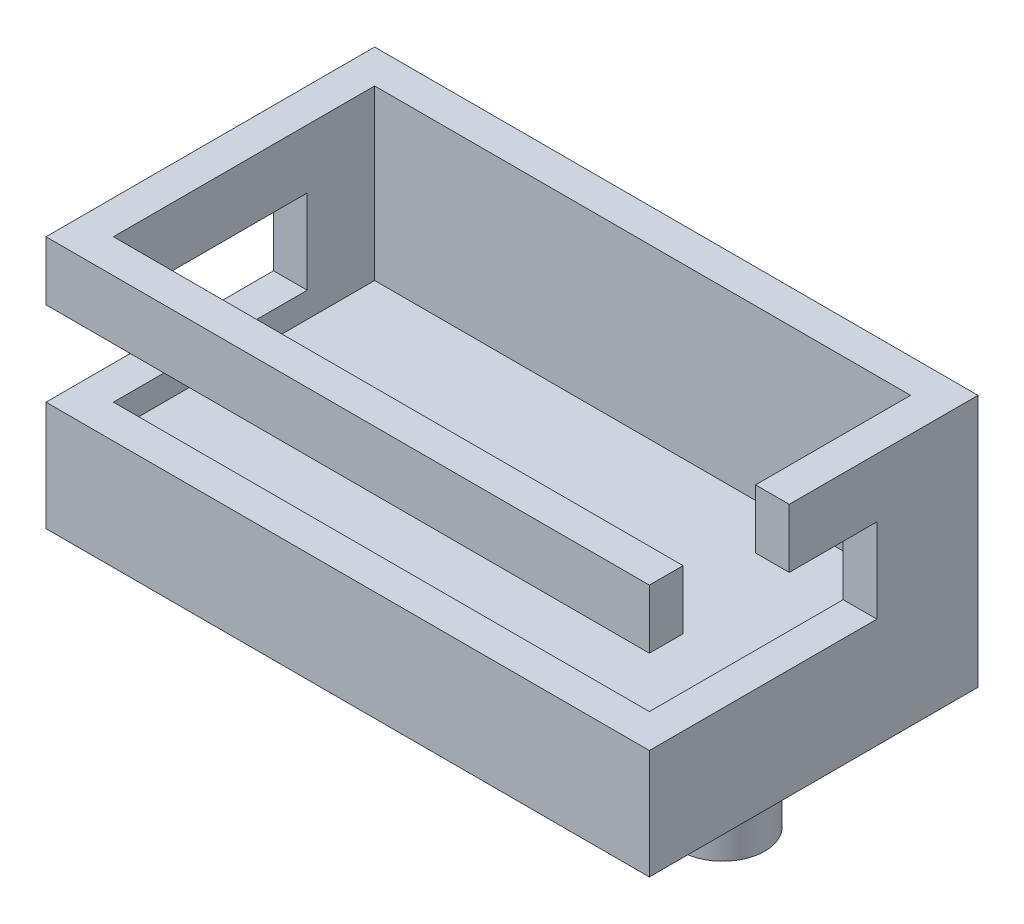
from build123d import *

# Parameters (mm, degrees)
SKETCH1_W           = 35.8
SKETCH1_H           = 19.5
SKETCH1_W_2         = 31.8
SKETCH1_H_2         = 15.5
BOSS_EXTRUDE1_DEPTH = 10
SKETCH1_2_W         = 35.8
SKETCH1_2_H         = 19.5
SKETCH1_2_W_2       = 31.8
SKETCH1_2_H_2       = 15.5
BOSS_EXTRUDE2_DEPTH = 5
SKETCH2_W           = 35.8
SKETCH2_H           = 5
CUT_EXTRUDE1_DEPTH  = 13.5
SKETCH3_W           = 6.3
SKETCH3_H           = 3.5
CUT_EXTRUDE2_DEPTH  = 2
SKETCH4_R           = 2.5
BOSS_EXTRUDE3_DEPTH = 5
FILLET1_R           = 0.4


with BuildPart() as part:
    # Sketch1 → Boss-Extrude1 (new body)
    with BuildSketch(Plane(origin=(0, 0, 0), x_dir=(1, 0, 0), z_dir=(0, 1, 0))):
        with Locations((15.9, 7.75)):
            Rectangle(SKETCH1_W, SKETCH1_H)
        with Locations((15.9, 7.75)):
            Rectangle(SKETCH1_W_2, SKETCH1_H_2, mode=Mode.SUBTRACT)
    extrude(amount=BOSS_EXTRUDE1_DEPTH)

    # Sketch1<2> → Boss-Extrude2 (add)
    # profile 1 of 2: a face of its own
    with BuildSketch(Plane(origin=(0, 0, 0), x_dir=(1, 0, 0), z_dir=(0, 1, 0))):
        with Locations((15.9, 7.75)):
            Rectangle(SKETCH1_2_W, SKETCH1_2_H)
        with Locations((15.9, 7.75)):
            Rectangle(SKETCH1_2_W_2, SKETCH1_2_H_2, mode=Mode.SUBTRACT)
    # profile 2 of 2: a face of its own
    with BuildSketch(Plane(origin=(0, 0, 0), x_dir=(1, 0, 0), z_dir=(0, 1, 0))):
        with Locations((15.9, 7.75)):
            Rectangle(SKETCH1_2_W_2, SKETCH1_2_H_2)
    extrude(amount=-BOSS_EXTRUDE2_DEPTH)

    # Sketch2 → Cut-Extrude1 (cut)
    with BuildSketch(Plane.XY.offset(2)):
        with Locations((15.9, 4)):
            Rectangle(SKETCH2_W, SKETCH2_H)
    extrude(amount=-CUT_EXTRUDE1_DEPTH, mode=Mode.SUBTRACT)

    # Sketch3 → Cut-Extrude2 (cut)
    with BuildSketch(Plane(origin=(33.8, 0, 0), x_dir=(0, 0, -1), z_dir=(1, 0, 0))):
        with Locations((3.15, 8.25)):
            Rectangle(SKETCH3_W, SKETCH3_H)
    extrude(amount=-CUT_EXTRUDE2_DEPTH, mode=Mode.SUBTRACT)

    # Sketch4 → Boss-Extrude3 (add)
    with BuildSketch(Plane.XZ.offset(5)):
        with Locations(Location((3.4, -7.75, 0), (0, 0, 90))):
            Circle(SKETCH4_R)
        with Locations(Location((28.4, -7.75, 0), (0, 0, 90))):
            Circle(SKETCH4_R)
    extrude(amount=BOSS_EXTRUDE3_DEPTH)

    # Fillet1
    fillet1_edges = [part.edges().sort_by_distance(p)[0] for p in [
        (3.4, -5, -10.25),
        (28.4, -5, -10.25),
    ]]
    fillet(fillet1_edges, radius=FILLET1_R)


solid = part.part
